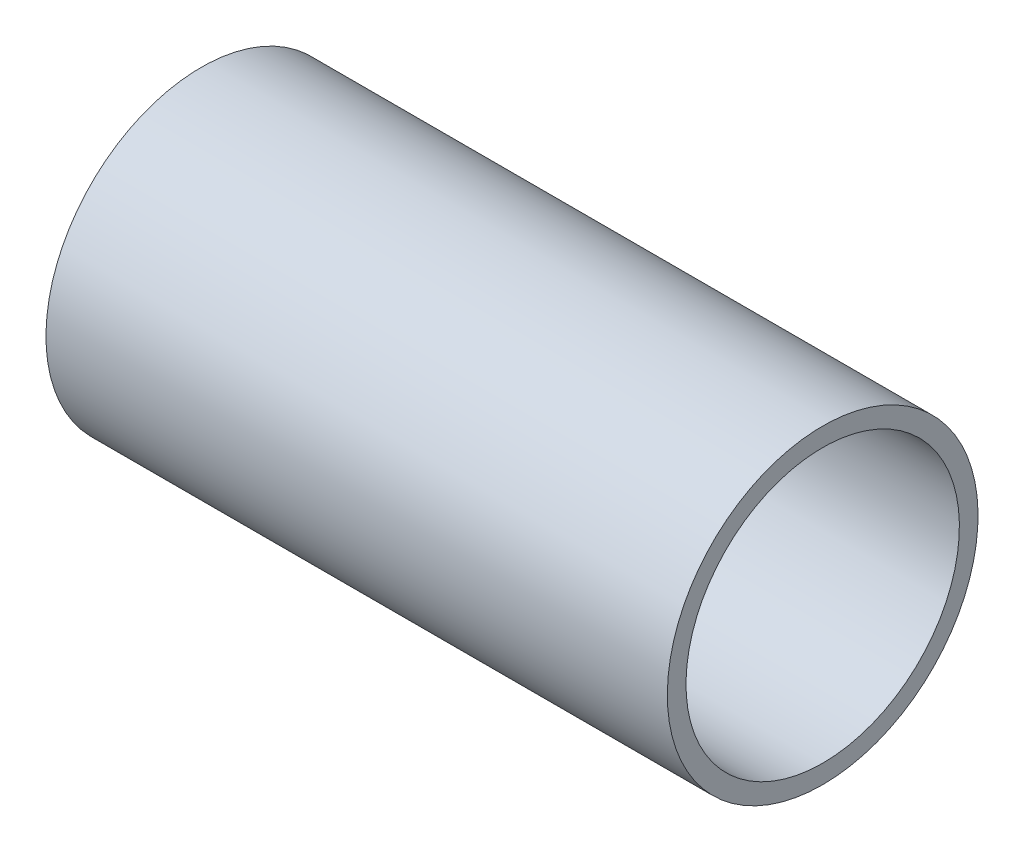
from build123d import *

# Parameters (mm, degrees)
SKETCH1_W = 100
SKETCH1_H = 3


with BuildPart() as part:
    # Sketch1 → Revolve1 (revolve)
    with BuildSketch(Plane.XY, mode=Mode.PRIVATE) as revolve1_sk:
        with Locations((50, 23.5)):
            Rectangle(SKETCH1_W, SKETCH1_H)
    revolve(revolve1_sk.sketch.rotate(Axis((0, 0, 0), (1, 0, 0)), 180), axis=Axis((0, 0, 0), (1, 0, 0)))


solid = part.part
